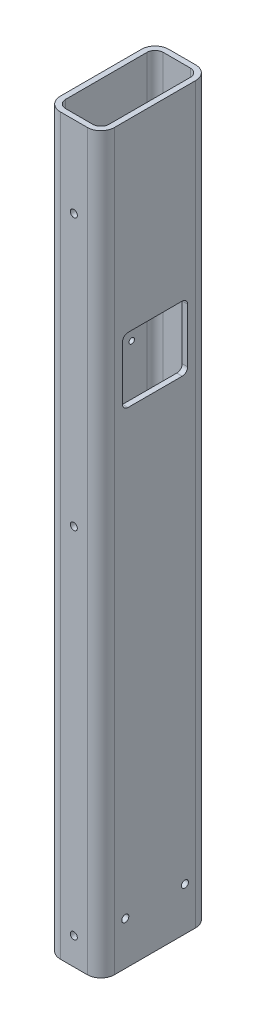
from build123d import *

# Parameters (mm, degrees)
RHS_C350_AS_100X50X5_0_RHS_C350_1_DEPTH = 677
SKETCH12_R                              = 2.25
CUT_EXTRUDE1_DEPTH                      = 10
CUT_EXTRUDE2_DEPTH                      = 10
SKETCH17_R                              = 12.5
SKETCH17_R_2                            = 2.5
CUT_EXTRUDE3_DEPTH                      = 10
SKETCH18_R                              = 3.25
CUT_EXTRUDE4_DEPTH                      = 354.846364966
SKETCH19_R                              = 3.25
CUT_EXTRUDE5_DEPTH                      = 354.846364966
SKETCH20_R                              = 3.25
CUT_EXTRUDE6_DEPTH                      = 346.806665638
SKETCH21_R                              = 2.25
CUT_EXTRUDE7_DEPTH                      = 10


with BuildPart() as part:
    # Sketch11 → Rhs c350 as 100X50X5.0 RHS C350(1) (new body)
    with BuildSketch(Plane(origin=(0, -338.5, 0), x_dir=(-1, 0, 0), z_dir=(0, 1, 0))):
        with BuildLine():
            Line((-12.5, -50), (12.5, -50))
            ThreePointArc((12.5, -50), (21.338834765, -46.338834765), (25, -37.5))
            Line((25, -37.5), (25, 37.5))
            ThreePointArc((25, 37.5), (21.338834765, 46.338834765), (12.5, 50))
            Line((12.5, 50), (-12.5, 50))
            ThreePointArc((-12.5, 50), (-21.338834765, 46.338834765), (-25, 37.5))
            Line((-25, 37.5), (-25, -37.5))
            ThreePointArc((-25, -37.5), (-21.338834765, -46.338834765), (-12.5, -50))
        make_face()
        with BuildLine():
            Line((-12.5, 45), (12.5, 45))
            ThreePointArc((12.5, 45), (17.803300859, 42.803300859), (20, 37.5))
            Line((20, 37.5), (20, -37.5))
            ThreePointArc((20, -37.5), (17.803300859, -42.803300859), (12.5, -45))
            Line((12.5, -45), (-12.5, -45))
            ThreePointArc((-12.5, -45), (-17.803300859, -42.803300859), (-20, -37.5))
            Line((-20, -37.5), (-20, 37.5))
            ThreePointArc((-20, 37.5), (-17.803300859, 42.803300859), (-12.5, 45))
        make_face(mode=Mode.SUBTRACT)
    extrude(amount=RHS_C350_AS_100X50X5_0_RHS_C350_1_DEPTH)

    # Sketch12 → Cut-Extrude1 (cut)
    with BuildSketch(Plane(origin=(25, 0, 0), x_dir=(0, 0, -1), z_dir=(1, 0, 0))):
        with Locations(Location((14.849242405, 153.349242405, 0), (0, 0, 90))):
            Circle(SKETCH12_R)
        with Locations(Location((-14.849242405, 153.349242405, 0), (0, 0, 90))):
            Circle(SKETCH12_R)
        with Locations(Location((-14.849242405, 123.650757595, 0), (0, 0, 90))):
            Circle(SKETCH12_R)
        with Locations(Location((14.849242405, 123.650757595, 0), (0, 0, 90))):
            Circle(SKETCH12_R)
    extrude(amount=-CUT_EXTRUDE1_DEPTH, mode=Mode.SUBTRACT)

    # Sketch16 → Cut-Extrude2 (cut)
    with BuildSketch(Plane(origin=(25, 0, 0), x_dir=(0, 0, -1), z_dir=(1, 0, 0))):
        with BuildLine():
            Line((-25, 108.5), (25, 108.5))
            ThreePointArc((25, 108.5), (28.535533906, 109.964466094), (30, 113.5))
            Line((30, 113.5), (30, 163.5))
            ThreePointArc((30, 163.5), (28.535533906, 167.035533906), (25, 168.5))
            Line((25, 168.5), (-25, 168.5))
            ThreePointArc((-25, 168.5), (-28.535533906, 167.035533906), (-30, 163.5))
            Line((-30, 163.5), (-30, 113.5))
            ThreePointArc((-30, 113.5), (-28.535533906, 109.964466094), (-25, 108.5))
        make_face()
    extrude(amount=-CUT_EXTRUDE2_DEPTH, mode=Mode.SUBTRACT)

    # Sketch17 → Cut-Extrude3 (cut)
    with BuildSketch(Plane(origin=(-20, 0, 0), x_dir=(0, 0, -1), z_dir=(1, 0, 0))):
        with Locations(Location((0, 138.5, 0), (0, 0, 90))):
            Circle(SKETCH17_R)
        with Locations(Location((-23.5, 162, 0), (0, 0, 90))):
            Circle(SKETCH17_R_2)
        with Locations(Location((23.5, 162, 0), (0, 0, 90))):
            Circle(SKETCH17_R_2)
        with Locations(Location((-23.5, 115, 0), (0, 0, 90))):
            Circle(SKETCH17_R_2)
        with Locations(Location((23.5, 115, 0), (0, 0, 90))):
            Circle(SKETCH17_R_2)
    extrude(amount=-CUT_EXTRUDE3_DEPTH, mode=Mode.SUBTRACT)

    # Sketch18 → Cut-Extrude4 (cut, through all)
    with BuildSketch(Plane(origin=(0, 0, -50), x_dir=(-1, 0, 0), z_dir=(0, 0, -1))):
        with Locations((0, 263.5)):
            Circle(SKETCH18_R)
        with Locations((0, 13.5)):
            Circle(SKETCH18_R)
    extrude(amount=-CUT_EXTRUDE4_DEPTH, mode=Mode.SUBTRACT)

    # Sketch19 → Cut-Extrude5 (cut, through all)
    with BuildSketch(Plane(origin=(0, 0, -50), x_dir=(-1, 0, 0), z_dir=(0, 0, -1))):
        with Locations((0, -313.5)):
            Circle(SKETCH19_R)
    extrude(amount=-CUT_EXTRUDE5_DEPTH, mode=Mode.SUBTRACT)

    # Sketch20 → Cut-Extrude6 (cut, through all)
    with BuildSketch(Plane(origin=(25, 0, 0), x_dir=(0, 0, -1), z_dir=(1, 0, 0))):
        with Locations(Location((27.5, -298.5, 0), (0, 0, 90))):
            Circle(SKETCH20_R)
        with Locations(Location((-27.5, -298.5, 0), (0, 0, 90))):
            Circle(SKETCH20_R)
    extrude(amount=-CUT_EXTRUDE6_DEPTH, mode=Mode.SUBTRACT)

    # Sketch21 → Cut-Extrude7 (cut)
    with BuildSketch(Plane(origin=(-20, 0, 0), x_dir=(0, 0, -1), z_dir=(1, 0, 0))):
        with Locations(Location((0, 160.5, 0), (0, 0, 90))):
            Circle(SKETCH21_R)
        with Locations(Location((22, 138.5, 0), (0, 0, 90))):
            Circle(SKETCH21_R)
        with Locations(Location((0, 116.5, 0), (0, 0, 90))):
            Circle(SKETCH21_R)
        with Locations(Location((-22, 138.5, 0), (0, 0, 90))):
            Circle(SKETCH21_R)
    extrude(amount=-CUT_EXTRUDE7_DEPTH, mode=Mode.SUBTRACT)


solid = part.part
